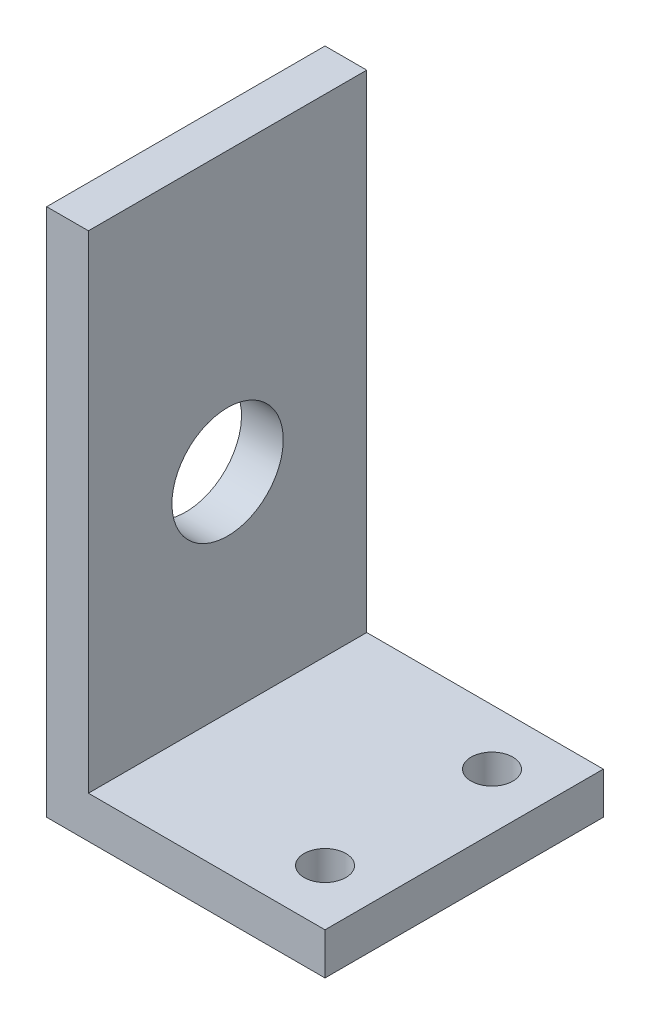
from build123d import *

# Parameters (mm, degrees)
EXTRUDE_1_DEPTH     = 20
SKETCH_2_R          = 1.5
CUT_EXTRUDE_1_DEPTH = 46
SKETCH_3_R          = 4
CUT_EXTRUDE_2_DEPTH = 47.184412955


with BuildPart() as part:
    # 草图1 → 凸台-拉伸1 (new body)
    with BuildSketch(Plane.XY):
        Polygon((0, 0), (0, 38), (3, 38), (3, 3), (20, 3), (20, 0), align=None)
    extrude(amount=EXTRUDE_1_DEPTH)

    # 草图2 → 切除-拉伸1 (cut, through all)
    with BuildSketch(Plane(origin=(0, 3, 0), x_dir=(1, 0, 0), z_dir=(0, 1, 0))):
        with Locations(Location((16, -16, 0), (0, 0, 270))):
            Circle(SKETCH_2_R)
        with Locations(Location((16, -4, 0), (0, 0, 270))):
            Circle(SKETCH_2_R)
    extrude(amount=-CUT_EXTRUDE_1_DEPTH, mode=Mode.SUBTRACT)

    # 草图3 → 切除-拉伸2 (cut, through all)
    with BuildSketch(Plane(origin=(3, 0, 0), x_dir=(0, 0, -1), z_dir=(1, 0, 0))):
        with Locations(Location((-10, 18, 0), (0, 0, 90))):
            Circle(SKETCH_3_R)
    extrude(amount=-CUT_EXTRUDE_2_DEPTH, mode=Mode.SUBTRACT)


solid = part.part
